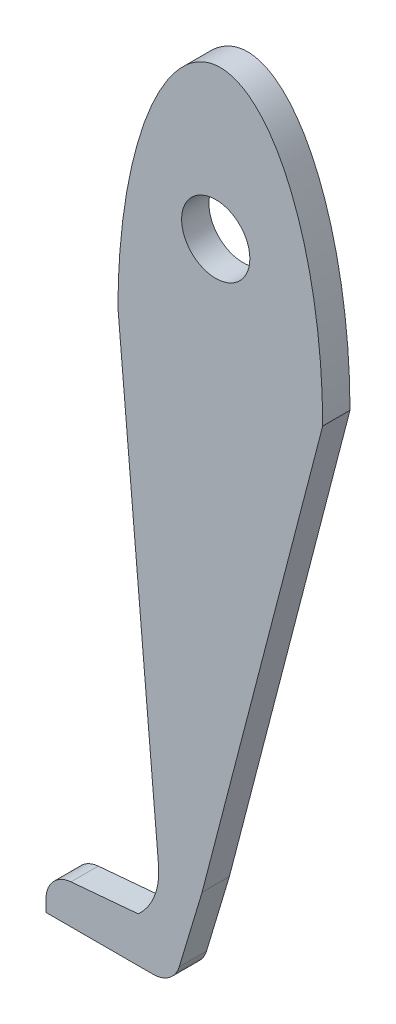
from build123d import *

# Parameters (mm, degrees)
BOSS_EXTRUDE1_DEPTH = 2
FILLET2_R           = 2
FILLET3_R           = 2
CUT_EXTRUDE4_DEPTH  = 2
SKETCH2_R           = 2.5
CUT_EXTRUDE5_DEPTH  = 2


with BuildPart() as part:
    # Sketch1 → Boss-Extrude1 (new body)
    with BuildSketch(Plane.XY):
        with BuildLine():
            Line((0, 0), (8.83647894, 34))
            add(Edge.make_bspline(
                [(8.83647894, 34), (8.83647894, 53), (1.33647894, 53), (-6.16352106, 53), (-6.16352106, 34)],
                knots=[4.71238898, 4.71238898, 4.71238898, 6.283185307, 6.283185307, 7.853981634, 7.853981634, 7.853981634], degree=2, weights=[1, 0.707106781, 1, 0.707106781, 1]))
            Line((-6.16352106, 34), (-3.180262594, 0))
            Line((-3.180262594, 0), (-4.671891827, -3.708387008))
            Line((-4.671891827, -3.708387008), (-11.435278617, -4.301826152))
            Line((-11.435278617, -4.301826152), (-11.435278617, -7))
            Line((-11.435278617, -7), (-2.106289546, -7))
            Line((-2.106289546, -7), (0, 0))
        make_face()
    extrude(amount=BOSS_EXTRUDE1_DEPTH)

    # Fillet2
    fillet2_edges = [part.edges().sort_by_distance(p)[0] for p in [
        (-11.435278617, -4.301826152, 1),
    ]]
    fillet(fillet2_edges, radius=FILLET2_R)

    # Fillet3
    fillet3_edges = [part.edges().sort_by_distance(p)[0] for p in [
        (-2.106289546, -7, 1),
    ]]
    fillet(fillet3_edges, radius=FILLET3_R)

    # Sketch4 → Cut-Extrude4 (cut)
    with BuildSketch(Plane.XY.offset(2)):
        with BuildLine():
            Line((-3.180262594, 0), (-4.671891827, -3.708387008))
            ThreePointArc((-4.671891827, -3.708387008), (-3.503150613, -2.024307808), (-3.180262594, 0))
        make_face()
    extrude(amount=-CUT_EXTRUDE4_DEPTH, mode=Mode.SUBTRACT)

    # Sketch2 → Cut-Extrude5 (cut)
    with BuildSketch(Plane.XY.offset(2)):
        with Locations((1, 41.95)):
            Circle(SKETCH2_R)
    extrude(amount=-CUT_EXTRUDE5_DEPTH, mode=Mode.SUBTRACT)


solid = part.part
